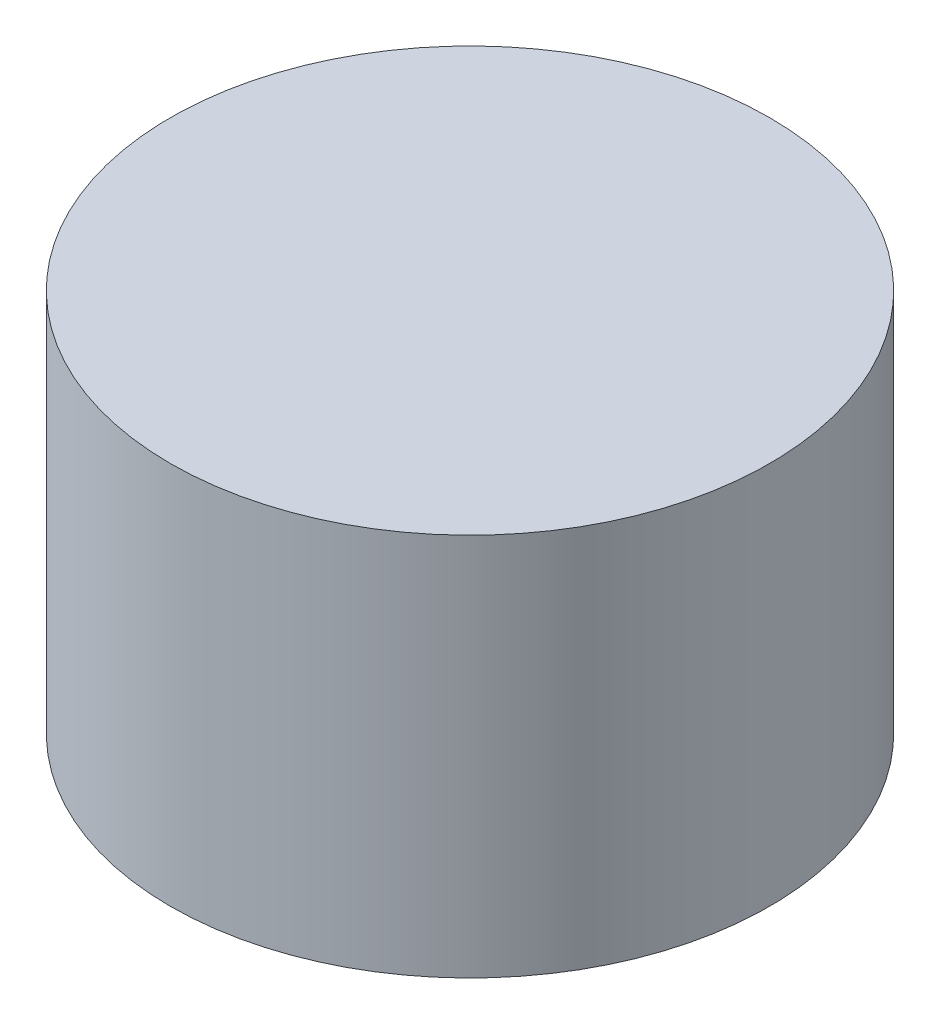
from build123d import *


with BuildPart() as part:
    # Sketch1 → Revolve1 (revolve)
    with BuildSketch(Plane(origin=(0, 0, 0), x_dir=(0, 0, -1), z_dir=(1, 0, 0))):
        Polygon((0, 0), (1612.9, 0), (1612.9, -2064.512), (1451.61, -2064.512), (1451.61, -482.6), (0, -482.6), align=None)
    revolve(axis=Axis((0, -482.6, 0), (0, 1, 0)))


solid = part.part
